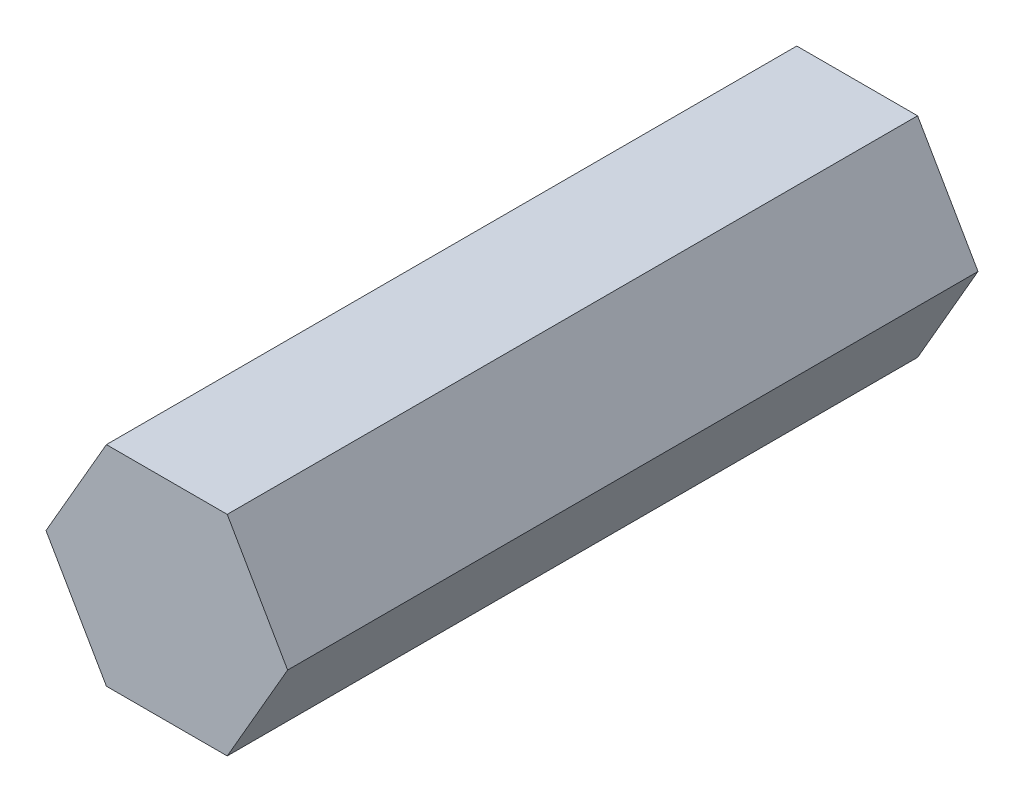
from build123d import *

# Parameters (mm, degrees)
EXTRUDE_1_DEPTH = 200


with BuildPart() as part:
    # 스케치1 → 보스-돌출1 (new body)
    with BuildSketch(Plane.XY):
        Polygon((35, 0), (17.5, 30.310889132), (-17.5, 30.310889132), (-35, 0), (-17.5, -30.310889132), (17.5, -30.310889132), align=None)
    extrude(amount=EXTRUDE_1_DEPTH)


solid = part.part
